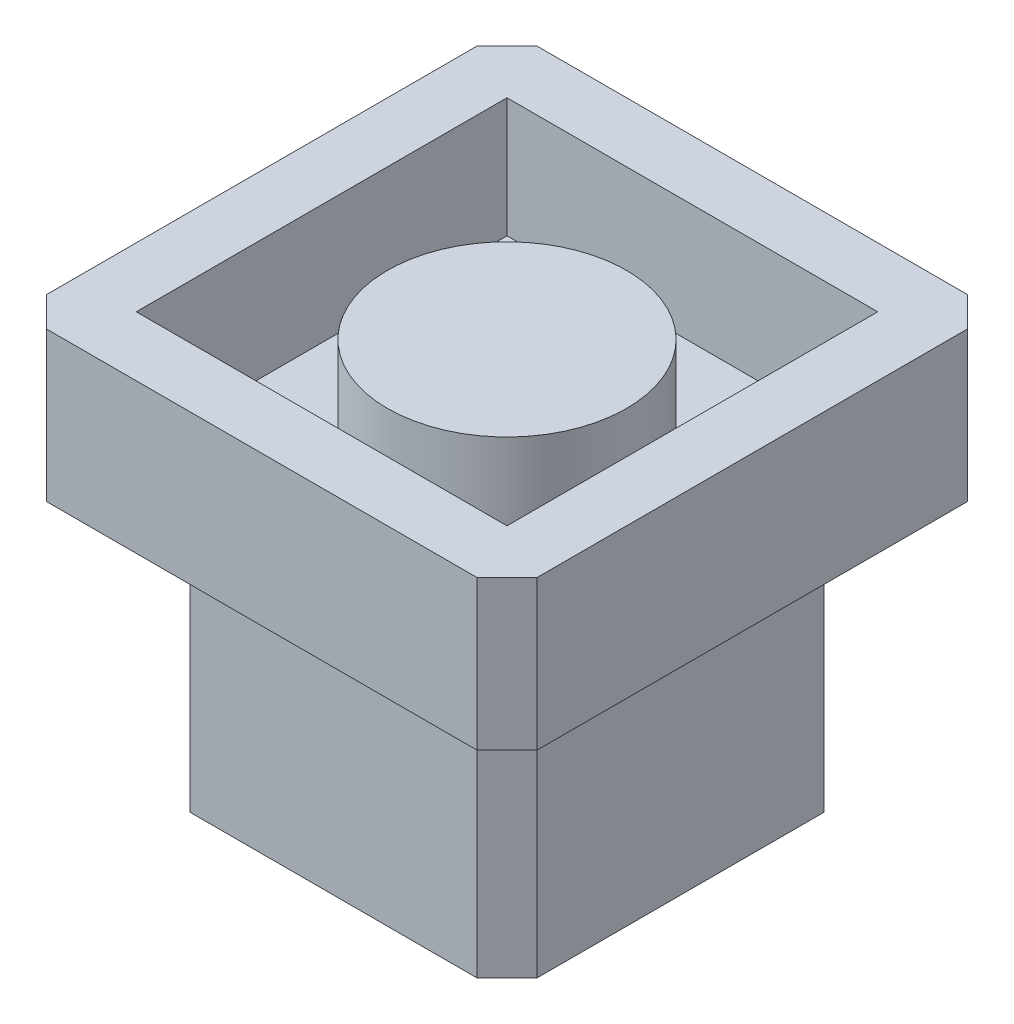
from build123d import *

# Parameters (mm, degrees)
SKETCH1_R           = 2
BOSS_EXTRUDE1_DEPTH = 1.6
SKETCH1_3_W         = 8.2
SKETCH1_3_H         = 8.2
SKETCH1_3_W_2       = 6.2
SKETCH1_3_H_2       = 6.2
BOSS_EXTRUDE2_DEPTH = 2
SKETCH1_4_W         = 8.2
SKETCH1_4_H         = 8.2
BOSS_EXTRUDE3_DEPTH = 0.5
SKETCH3_W           = 5.8
SKETCH3_H           = 5.8
BOSS_EXTRUDE4_DEPTH = 4.5
CHAMFER1_SIZE       = 0.5
CUT_EXTRUDE1_DEPTH  = 0.2


with BuildPart() as part:
    # Sketch1 → Boss-Extrude1 (new body)
    with BuildSketch(Plane(origin=(0, 0, 0), x_dir=(1, 0, 0), z_dir=(0, 1, 0))):
        Circle(SKETCH1_R)
    extrude(amount=BOSS_EXTRUDE1_DEPTH)



with BuildPart() as body_2:
    # Sketch1<3> → Boss-Extrude2 (new body)
    with BuildSketch(Plane(origin=(0, 0, 0), x_dir=(1, 0, 0), z_dir=(0, 1, 0))):
        Rectangle(SKETCH1_3_W, SKETCH1_3_H)
        Rectangle(SKETCH1_3_W_2, SKETCH1_3_H_2, mode=Mode.SUBTRACT)
    extrude(amount=BOSS_EXTRUDE2_DEPTH)


with BuildPart() as part_1:
    add(part.part)

    add(body_2.part)  # Boss-Extrude3 merges body 2
    # Sketch1<4> → Boss-Extrude3 (add)
    with BuildSketch(Plane(origin=(0, 0, 0), x_dir=(1, 0, 0), z_dir=(0, 1, 0))):
        Rectangle(SKETCH1_4_W, SKETCH1_4_H)
    extrude(amount=-BOSS_EXTRUDE3_DEPTH)

    # Sketch3 → Boss-Extrude4 (add)
    with BuildSketch(Plane.XZ.offset(0.5)):
        Rectangle(SKETCH3_W, SKETCH3_H)
    extrude(amount=BOSS_EXTRUDE4_DEPTH)

    # Chamfer1
    chamfer1_edges = [part_1.edges().sort_by_distance(p)[0] for p in [
        (-4.1, 0.75, -4.1),
        (4.1, 0.75, -4.1),
        (-4.1, 0.75, 4.1),
        (4.1, 0.75, 4.1),
        (-2.9, -2.75, 2.9),
        (2.9, -2.75, 2.9),
        (-2.9, -2.75, -2.9),
        (2.9, -2.75, -2.9),
    ]]
    chamfer(chamfer1_edges, length=CHAMFER1_SIZE)

    # Sketch4 → Cut-Extrude1 (cut)
    with BuildSketch(Plane.XZ.offset(5)):
        with BuildLine():
            Line((-1.178429818, -1.660582309), (-1.178429818, 1.839417691))
            Line((-1.178429818, 1.839417691), (-0.471699048, 1.839417691))
            add(Edge.make_bspline(
                [(-0.471699048, 1.839417691), (-0.41023006, 1.838975121), (-0.291472295, 1.838120078), (-0.119859847, 1.832698686), (0.038923915, 1.823108221), (0.184356774, 1.809138694), (0.316837986, 1.791985661), (0.435996594, 1.770485257), (0.542448737, 1.745097086), (0.607918178, 1.723451636), (0.638877875, 1.713215767)],
                knots=[0, 0, 0, 0, 1.314313732, 2.53924729, 3.670748893, 4.714932338, 5.66265055, 6.526160246, 7.303039223, 8, 8, 8, 8], degree=3))
            add(Edge.make_bspline(
                [(0.638877875, 1.713215767), (0.679372614, 1.697785062), (0.759443806, 1.667273568), (0.873450929, 1.609717266), (0.980776292, 1.544504165), (1.081995437, 1.471548302), (1.174796263, 1.388783953), (1.26280416, 1.299726868), (1.342418884, 1.201138528), (1.41532718, 1.09506354), (1.481062839, 0.982751487), (1.538201997, 0.864416379), (1.58565599, 0.740659171), (1.625049217, 0.611824023), (1.656095674, 0.477627645), (1.677277606, 0.337913779), (1.691248596, 0.193234589), (1.692652647, 0.095060126), (1.693365054, 0.045247017)],
                knots=[0, 0, 0, 0, 0.984719456, 1.947108742, 2.898477687, 3.838006223, 4.779231079, 5.722358779, 6.681677486, 7.655904652, 8.64651281, 9.637519902, 10.640069247, 11.656948941, 12.698408672, 13.768548281, 14.867775369, 16, 16, 16, 16], degree=3))
            add(Edge.make_bspline(
                [(1.693365054, 0.045247017), (1.692736087, 0.001985779), (1.691496641, -0.08326501), (1.680367325, -0.208905906), (1.664191005, -0.330819477), (1.639146807, -0.448425177), (1.608744293, -0.562753395), (1.569780142, -0.672585639), (1.525144646, -0.778929449), (1.473094767, -0.880346924), (1.415953382, -0.976430297), (1.354631639, -1.067005825), (1.289194944, -1.150781047), (1.219019311, -1.228009659), (1.145011594, -1.298575237), (1.066687264, -1.363067252), (0.983844213, -1.420223807), (0.89685349, -1.472290916), (0.803177361, -1.517711271), (0.701041495, -1.556141281), (0.590010317, -1.587987896), (0.47035636, -1.614558792), (0.341872882, -1.635636095), (0.204433916, -1.649762487), (0.058250627, -1.65931542), (-0.042128638, -1.660151813), (-0.093794401, -1.660582309)],
                knots=[0, 0, 0, 0, 1.105936401, 2.179363191, 3.223086493, 4.248585256, 5.251745608, 6.245858792, 7.225916811, 8.198733463, 9.158002045, 10.082870192, 10.993790845, 11.873723703, 12.748670949, 13.606408763, 14.465103618, 15.319838547, 16.196477973, 17.123216899, 18.106603292, 19.147568657, 20.255746949, 21.433717677, 22.679120308, 24, 24, 24, 24], degree=3))
            Line((-0.093794401, -1.660582309), (-1.178429818, -1.660582309))
        make_face()
        with BuildLine():
            Line((-0.864327254, -1.30160795), (-0.462584465, -1.30160795))
            add(Edge.make_bspline(
                [(-0.462584465, -1.30160795), (-0.404856094, -1.301359854), (-0.293823296, -1.300882674), (-0.134165299, -1.296695471), (0.011714098, -1.289853533), (0.143835607, -1.280278455), (0.262124632, -1.26760984), (0.366828381, -1.253484938), (0.45760364, -1.235887487), (0.512533077, -1.219936527), (0.537916336, -1.212565483)],
                knots=[0, 0, 0, 0, 1.375205317, 2.645023457, 3.804390687, 4.853969522, 5.800190428, 6.637939096, 7.370582563, 8, 8, 8, 8], degree=3))
            add(Edge.make_bspline(
                [(0.537916336, -1.212565483), (0.569864698, -1.201313924), (0.632998337, -1.179079551), (0.723879422, -1.13852189), (0.808636426, -1.09047982), (0.888746452, -1.037077546), (0.963073107, -0.976431544), (1.032497223, -0.909860555), (1.096879025, -0.83702578), (1.155553333, -0.758017619), (1.208061637, -0.673327823), (1.253532866, -0.583788989), (1.293384398, -0.490382179), (1.32466299, -0.39167302), (1.349178575, -0.288543962), (1.366543263, -0.180987749), (1.377357987, -0.069024467), (1.378619435, 0.007127657), (1.37926249, 0.045948139)],
                knots=[0, 0, 0, 0, 0.998632004, 1.973411704, 2.929992603, 3.868527914, 4.809262121, 5.754881198, 6.702106254, 7.672490631, 8.653608572, 9.636854334, 10.631411391, 11.644891563, 12.686317036, 13.754757253, 14.855430412, 16, 16, 16, 16], degree=3))
            add(Edge.make_bspline(
                [(1.37926249, 0.045948139), (1.378749203, 0.08688162), (1.377740845, 0.167295804), (1.365066535, 0.285286499), (1.346544979, 0.39876715), (1.319761293, 0.507745345), (1.285630414, 0.612433697), (1.243035773, 0.712253207), (1.194369153, 0.808258076), (1.136465816, 0.898232442), (1.073050223, 0.983325551), (1.002672344, 1.061280467), (0.926450305, 1.132274767), (0.845215456, 1.19741408), (0.756678357, 1.254077756), (0.662924666, 1.304764437), (0.562578995, 1.347780328), (0.492766299, 1.370659191), (0.45728733, 1.38228628)],
                knots=[0, 0, 0, 0, 1.122418816, 2.205001699, 3.251619955, 4.274784885, 5.280384055, 6.268708349, 7.249350384, 8.229342522, 9.199999885, 10.157847722, 11.105861043, 12.055065948, 13.010012805, 13.98527497, 14.976112212, 16, 16, 16, 16], degree=3))
            add(Edge.make_bspline(
                [(0.45728733, 1.38228628), (0.427936183, 1.390402708), (0.365527593, 1.407660461), (0.263688129, 1.426485833), (0.14907298, 1.443090332), (0.021173279, 1.457148372), (-0.11986518, 1.467235693), (-0.274150868, 1.474807008), (-0.441750473, 1.47991364), (-0.557933007, 1.480262347), (-0.618233504, 1.480443332)],
                knots=[0, 0, 0, 0, 0.674548936, 1.434276114, 2.292660221, 3.240891867, 4.284742987, 5.42552168, 6.663806718, 8, 8, 8, 8], degree=3))
            Line((-0.618233504, 1.480443332), (-0.864327254, 1.480443332))
            Line((-0.864327254, 1.480443332), (-0.864327254, -1.30160795))
        make_face(mode=Mode.SUBTRACT)
    extrude(amount=-CUT_EXTRUDE1_DEPTH, mode=Mode.SUBTRACT)


solid = part_1.part
